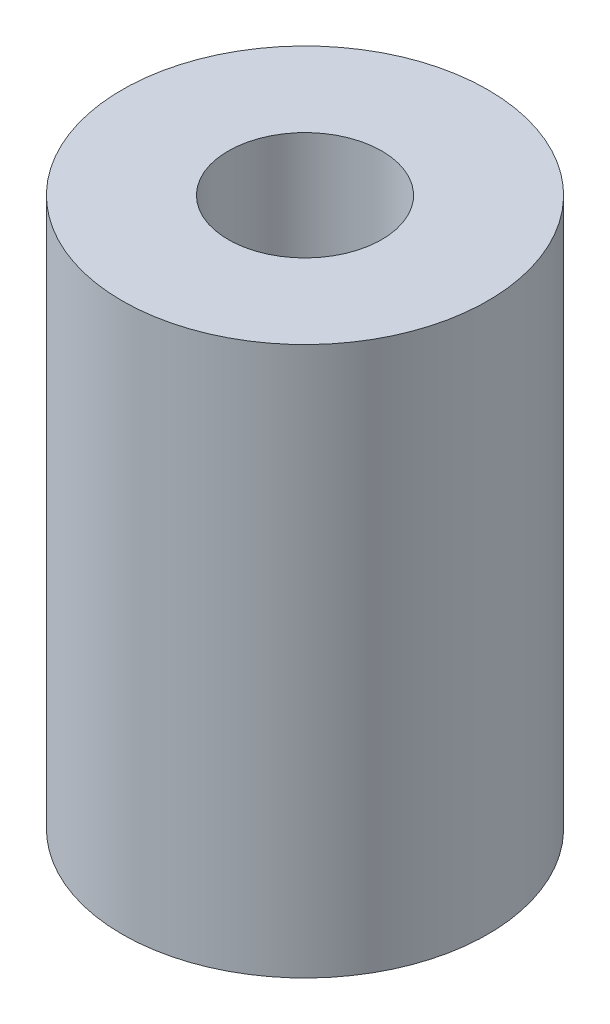
from build123d import *

# Parameters (mm, degrees)
SKETCH1_R           = 6.35
SKETCH1_R_2         = 2.667
BOSS_EXTRUDE1_DEPTH = 19.05


with BuildPart() as part:
    # Sketch1 → Boss-Extrude1 (new body)
    with BuildSketch(Plane(origin=(0, 0, 0), x_dir=(1, 0, 0), z_dir=(0, 1, 0))):
        Circle(SKETCH1_R)
        Circle(SKETCH1_R_2, mode=Mode.SUBTRACT)
    extrude(amount=BOSS_EXTRUDE1_DEPTH)


solid = part.part
